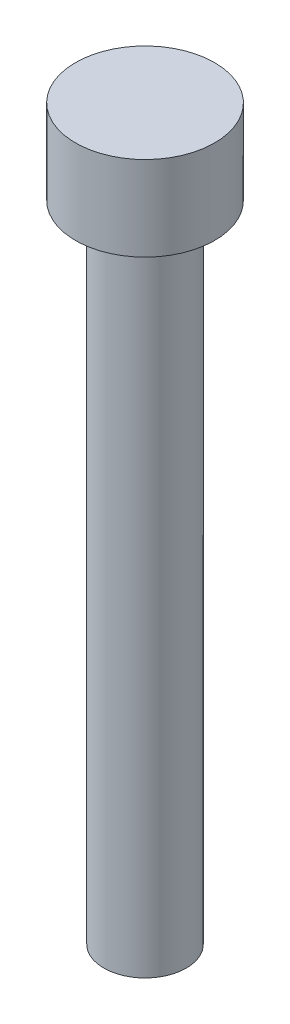
from build123d import *


with BuildPart() as part:
    # Sketch1 → Revolve1 (revolve)
    with BuildSketch(Plane.XY, mode=Mode.PRIVATE) as revolve1_sk:
        Polygon((0, 0), (0, 35.9156), (3.429, 35.9156), (3.429, 31.75), (2.032, 31.75), (2.032, 0), align=None)
    revolve(revolve1_sk.sketch.rotate(Axis((0, 0, 0), (0, 1, 0)), 90), axis=Axis((0, 0, 0), (0, 1, 0)))


solid = part.part
